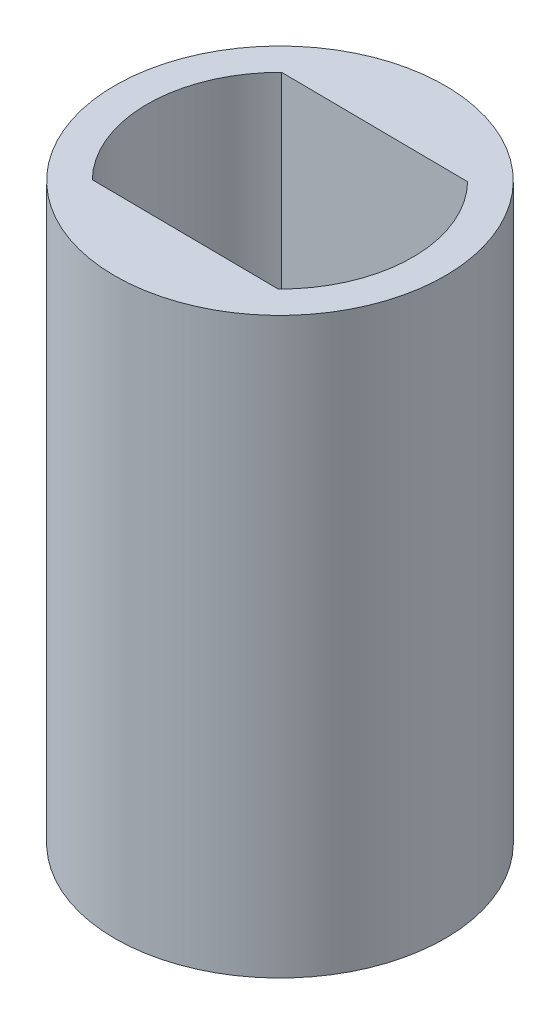
from build123d import *

# Parameters (mm, degrees)
SKETCH1_R           = 3.45
BOSS_EXTRUDE1_DEPTH = 12
CUT_EXTRUDE1_DEPTH  = 6
SKETCH3_3_W         = 1.9
SKETCH3_3_H         = 1.9
SKETCH3_3_W_2       = 1.49
SKETCH3_3_H_2       = 1.49
CUT_EXTRUDE3_DEPTH  = 6
SKETCH3_W           = 1.9
SKETCH3_H           = 1.9
SKETCH3_W_2         = 1.49
SKETCH3_H_2         = 1.49
CUT_EXTRUDE2_DEPTH  = 6


with BuildPart() as part:
    # Sketch1 → Boss-Extrude1 (new body)
    with BuildSketch(Plane(origin=(0, 0, 0), x_dir=(1, 0, 0), z_dir=(0, 1, 0))):
        with Locations(Location((0, 0, 0), (0, 0, 270))):
            Circle(SKETCH1_R)
    extrude(amount=BOSS_EXTRUDE1_DEPTH)

    # Sketch2 → Cut-Extrude1 (cut)
    with BuildSketch(Plane(origin=(0, 12, 0), x_dir=(1, 0, 0), z_dir=(0, 1, 0))):
        with BuildLine():
            Line((-1.980523516, -1.943746794), (1.943746794, -1.980523516))
            ThreePointArc((1.943746794, -1.980523516), (2.558761649, -1.073947775), (2.775, 0))
            ThreePointArc((2.775, 0), (2.568713468, 1.049921959), (1.980523516, 1.943746794))
            Line((1.980523516, 1.943746794), (-1.943746794, 1.980523516))
            ThreePointArc((-1.943746794, 1.980523516), (-2.774878148, 0.026005069), (-1.980523516, -1.943746794))
        make_face()
    extrude(amount=-CUT_EXTRUDE1_DEPTH, mode=Mode.SUBTRACT)

    # Sketch3<3> → Cut-Extrude3 (cut)
    with BuildSketch(Plane.XZ):
        Rectangle(SKETCH3_3_W, SKETCH3_3_H)
        with Locations((-1.695, 0)):
            Rectangle(SKETCH3_3_W_2, SKETCH3_3_H)
        with Locations((1.695, 0)):
            Rectangle(SKETCH3_3_W_2, SKETCH3_3_H)
        with Locations((0, -1.695)):
            Rectangle(SKETCH3_3_W, SKETCH3_3_H_2)
        with Locations((0, 1.695)):
            Rectangle(SKETCH3_3_W, SKETCH3_3_H_2)
    extrude(amount=-CUT_EXTRUDE3_DEPTH, mode=Mode.SUBTRACT)

    # Sketch3 → Cut-Extrude2 (cut)
    with BuildSketch(Plane.XZ):
        Rectangle(SKETCH3_W, SKETCH3_H)
        with Locations((-1.695, 0)):
            Rectangle(SKETCH3_W_2, SKETCH3_H)
        with Locations((0, -1.695)):
            Rectangle(SKETCH3_W, SKETCH3_H_2)
        with Locations((1.695, 0)):
            Rectangle(SKETCH3_W_2, SKETCH3_H)
        with Locations((0, 1.695)):
            Rectangle(SKETCH3_W, SKETCH3_H_2)
    extrude(amount=-CUT_EXTRUDE2_DEPTH, mode=Mode.SUBTRACT)


solid = part.part
